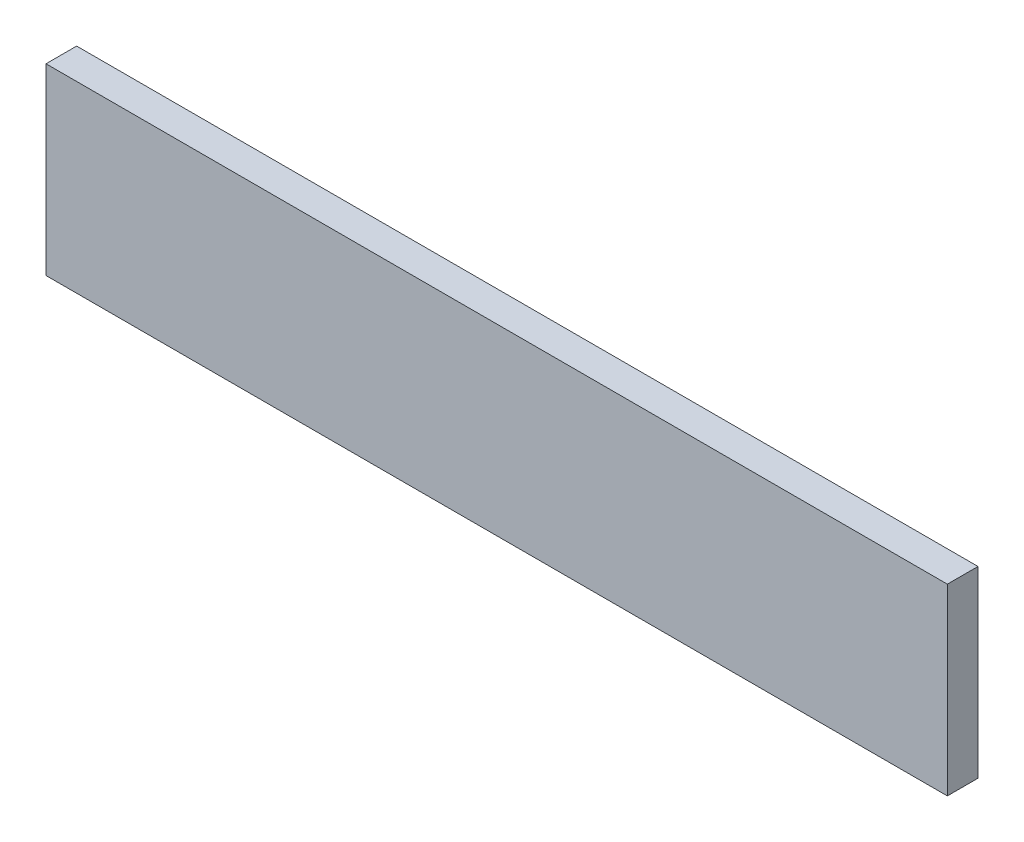
from build123d import *

# Parameters (mm, degrees)
SKETCH1_W           = 294
SKETCH1_H           = 59.82575695
BOSS_EXTRUDE1_DEPTH = 10


with BuildPart() as part:
    # Sketch1 → Boss-Extrude1 (new body)
    with BuildSketch(Plane.XY):
        with Locations((-120.300605602, -308.244215253)):
            Rectangle(SKETCH1_W, SKETCH1_H)
    extrude(amount=BOSS_EXTRUDE1_DEPTH)


solid = part.part
